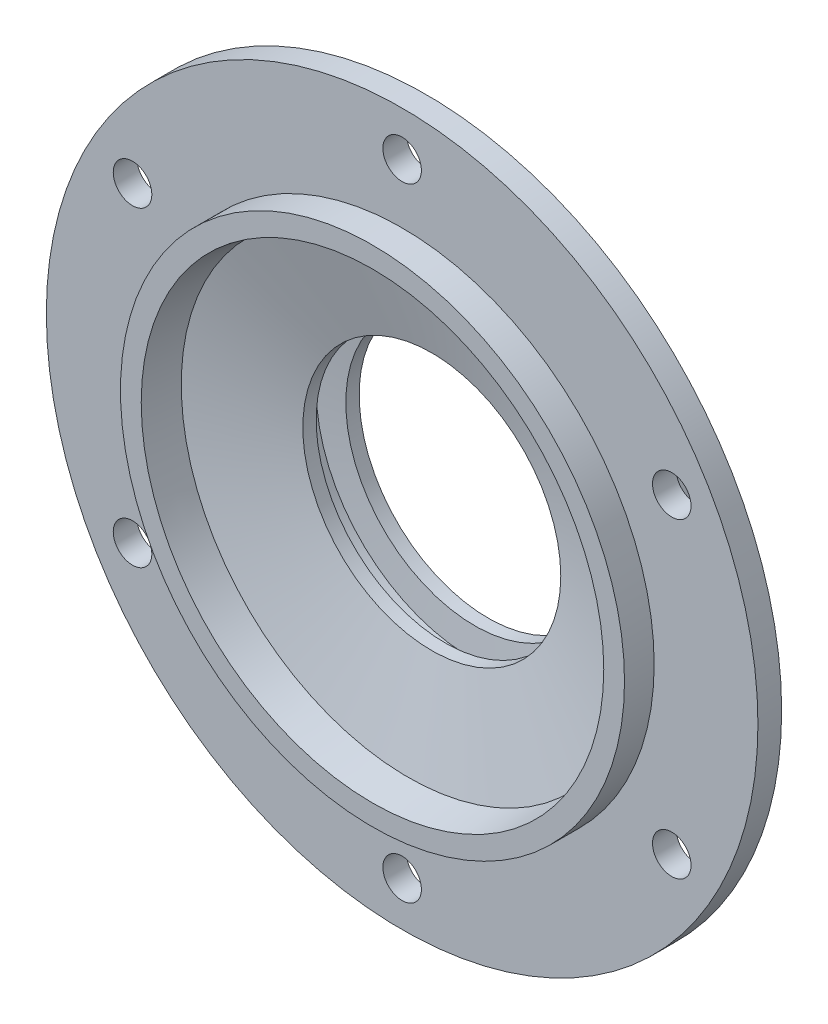
from build123d import *

# Parameters (mm, degrees)
SKETCH_2_R               = 6.5
CUT_EXTRUDE_1_DEPTH      = 172
PATTERN_CIRCULAR_1_COUNT = 6


with BuildPart() as part:
    # 草图1 → 旋转1 (revolve)
    with BuildSketch(Plane(origin=(0, 0, 0), x_dir=(0, 0, -1), z_dir=(1, 0, 0)), mode=Mode.PRIVATE) as revolve_1_sk:
        Polygon((-9.5, 43.5), (-5, 43.5), (-4, 52.5), (4, 52.5), (5, 43.5), (9.5, 43.5), (9.5, 63), (2.5, 63), (2.5, 85), (-11.5, 85), (-11.5, 120), (-19.5, 120), (-19.5, 85), (-29.5, 85), (-29.5, 78), (-17.5, 76.5), align=None)
    revolve(revolve_1_sk.sketch.rotate(Axis((0, 0, 1000), (0, 0, -1)), 90), axis=Axis((0, 0, 1000), (0, 0, -1)))

    # 草图2 → 切除-拉伸1 (cut, through all)
    with BuildSketch(Plane(origin=(0, 0, 11.5), x_dir=(-1, 0, 0), z_dir=(0, 0, -1))):
        with Locations((0, 105)):
            Circle(SKETCH_2_R)
    cut_extrude_1 = extrude(amount=-CUT_EXTRUDE_1_DEPTH, mode=Mode.SUBTRACT)

    # 阵列(圆周)1: 切除-拉伸1 ×6 about axis
    pattern_circular_1_axis = Axis((0, 0, 0), (0, 0, 1))
    for i in range(1, PATTERN_CIRCULAR_1_COUNT):
        add(cut_extrude_1.rotate(pattern_circular_1_axis, i * 360 / PATTERN_CIRCULAR_1_COUNT), mode=Mode.SUBTRACT)


solid = part.part
